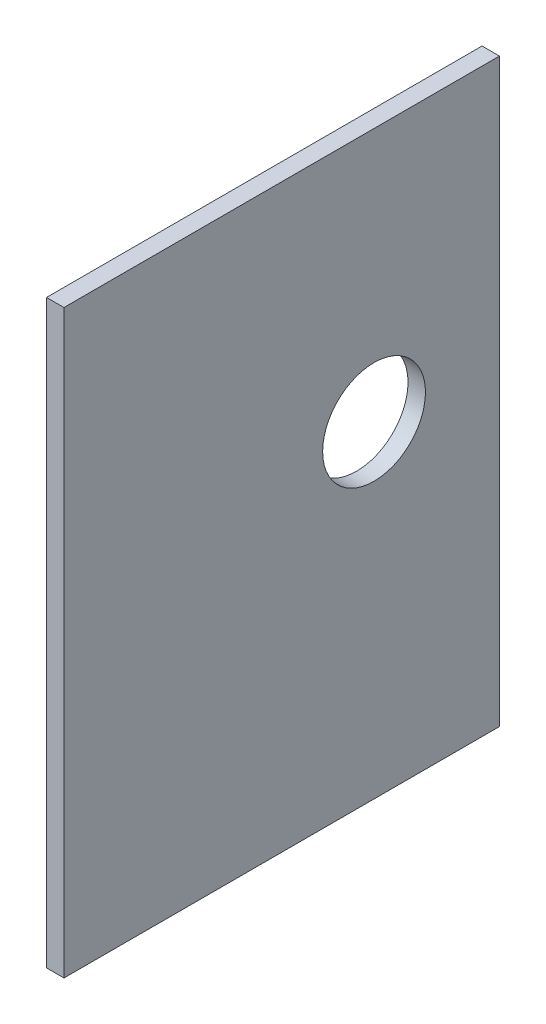
from build123d import *

# Parameters (mm, degrees)
SKETCH1_W           = 190.5
SKETCH1_H           = 254
SKETCH1_R           = 22.479
BOSS_EXTRUDE1_DEPTH = 7.62


with BuildPart() as part:
    # Sketch1 → Boss-Extrude1 (new body)
    with BuildSketch(Plane(origin=(0, 0, 0), x_dir=(0, 0, -1), z_dir=(1, 0, 0))):
        Rectangle(SKETCH1_W, SKETCH1_H)
        with Locations(Location((40.38632569, 15.837125703, 0), (0, 0, 180))):
            Circle(SKETCH1_R, mode=Mode.SUBTRACT)
    extrude(amount=BOSS_EXTRUDE1_DEPTH)


solid = part.part
